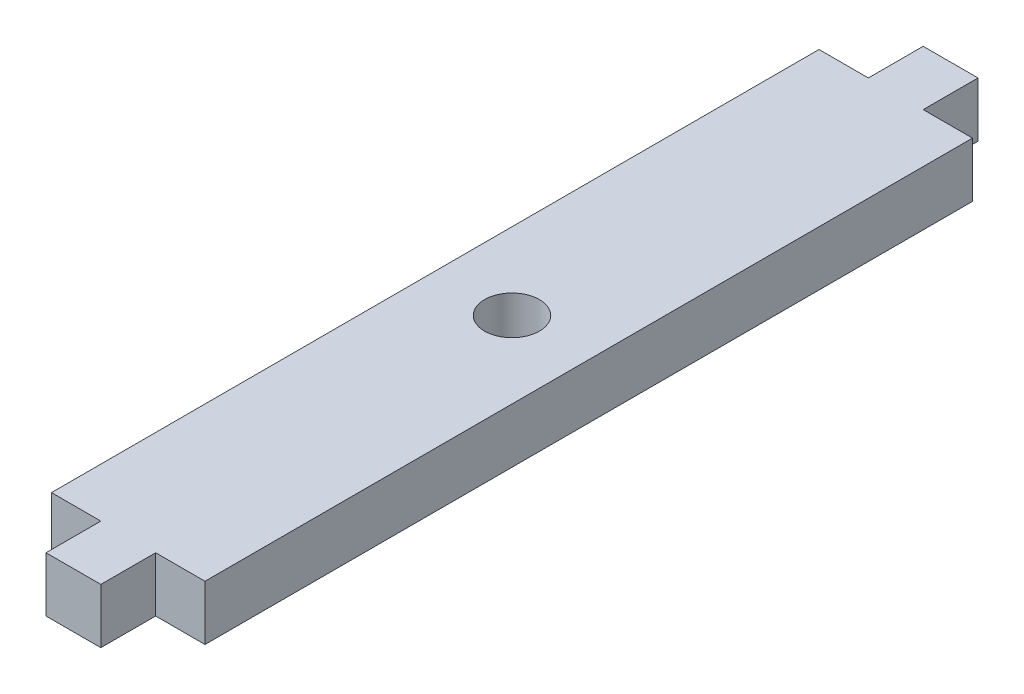
from build123d import *

# Parameters (mm, degrees)
SKETCH1_R           = 3.175
BOSS_EXTRUDE1_DEPTH = 6.35


with BuildPart() as part:
    # Sketch1 → Boss-Extrude1 (new body)
    with BuildSketch(Plane(origin=(0, 0, 0), x_dir=(1, 0, 0), z_dir=(0, 1, 0))):
        Polygon((0, 0), (0, 17.78), (-5.715, 17.78), (-5.715, 24.13), (-12.065, 24.13), (-12.065, 17.78), (-17.78, 17.78), (-17.78, 0), (-17.78, -53.34), (-17.78, -71.12), (-12.065, -71.12), (-12.065, -77.47), (-5.715, -77.47), (-5.715, -71.12), (0, -71.12), (0, -53.34), align=None)
        with Locations(Location((-8.89, -26.67, 0), (0, 0, 270))):
            Circle(SKETCH1_R, mode=Mode.SUBTRACT)
    extrude(amount=BOSS_EXTRUDE1_DEPTH)


solid = part.part
